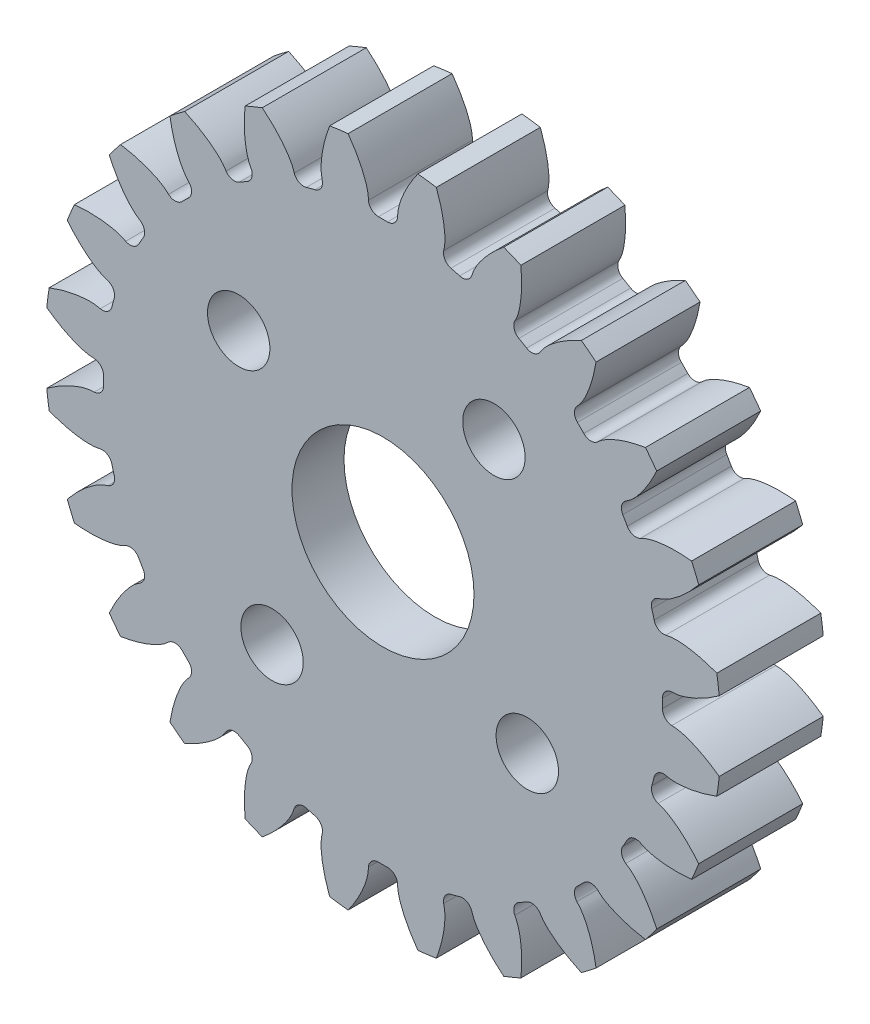
from build123d import *

# Parameters (mm, degrees)
SKETCH_1_R             = 13
LASHENA_DEPTH          = 4
CUT_EXTRUDEA_DEPTH     = 30
WWW_KYTOOL_CN_COUNT    = 24
SKETCH_3_R             = 10.375
CUT_EXTRUDE_2_DEPTH    = 2
HOLE_WIZARD_M2_2_D     = 2.4
HOLE_WIZARD_M2_2_DEPTH = 4
CUT_EXTRUDE_3_REACH    = 20.719
SKETCH_8_R             = 3.5


with BuildPart() as part:
    # 草图1 → LaShenA (new body)
    with BuildSketch(Plane.XY):
        Circle(SKETCH_1_R)
    extrude(amount=LASHENA_DEPTH)

    # SketchA → Cut-ExtrudeA (cut)
    with BuildSketch(Plane.XY.offset(4)):
        with BuildLine():
            ThreePointArc((0.173196471, 10.748604699), (0, 10.75), (-0.173196471, 10.748604699))
            ThreePointArc((-0.173196471, 10.748604699), (-0.437444919, 10.849681053), (-0.558609121, 11.105342759))
            add(Edge.make_bspline(
                [(-0.558609121, 11.105342759), (-0.561820005, 11.157808071), (-0.566676225, 11.241465147), (-0.579520194, 11.338853193), (-0.591720059, 11.399886775), (-0.602526477, 11.448246148), (-0.616487252, 11.503691621), (-0.63391432, 11.566103122), (-0.655198403, 11.635327615), (-0.680697435, 11.711203529), (-0.710772051, 11.793553084), (-0.745773672, 11.882184991), (-0.786047574, 11.976893898), (-0.831931307, 12.077460861), (-0.883754559, 12.183653528), (-0.941838585, 12.295226429), (-1.006495777, 12.411921251), (-1.078029212, 12.533467138), (-1.15673221, 12.659581005), (-1.2428879, 12.789967867), (-1.336768835, 12.924321173), (-1.438636448, 13.062323173), (-1.58856632, 13.254761753), (-1.709157908, 13.397453874), (-1.793555093, 13.492413967)],
                knots=[0.11976657, 0.11976657, 0.11976657, 0.11976657, 0.170317048, 0.200987551, 0.214488531, 0.230444233, 0.248854659, 0.269719807, 0.29303968, 0.318814275, 0.347043594, 0.377727635, 0.410866401, 0.446459889, 0.484508101, 0.525011036, 0.567968694, 0.613381076, 0.661248181, 0.711570009, 0.764346561, 0.819577836, 0.877263834, 1, 1, 1, 1], degree=3))
            ThreePointArc((-1.793555093, 13.492413967), (0, 13.611101151), (1.793555093, 13.492413967))
            add(Edge.make_bspline(
                [(0.558609121, 11.105342759), (0.561820005, 11.157808071), (0.566676225, 11.241465147), (0.579520194, 11.338853193), (0.591720059, 11.399886775), (0.602526477, 11.448246148), (0.616487252, 11.503691621), (0.63391432, 11.566103122), (0.655198403, 11.635327615), (0.680697435, 11.711203529), (0.710772051, 11.793553084), (0.745773672, 11.882184991), (0.786047574, 11.976893898), (0.831931307, 12.077460861), (0.883754559, 12.183653528), (0.941838585, 12.295226429), (1.006495777, 12.411921251), (1.078029212, 12.533467138), (1.15673221, 12.659581005), (1.2428879, 12.789967867), (1.336768835, 12.924321173), (1.438636448, 13.062323173), (1.58856632, 13.254761753), (1.709157908, 13.397453874), (1.793555093, 13.492413967)],
                knots=[0.11976657, 0.11976657, 0.11976657, 0.11976657, 0.170317048, 0.200987551, 0.214488531, 0.230444233, 0.248854659, 0.269719807, 0.29303968, 0.318814275, 0.347043594, 0.377727635, 0.410866401, 0.446459889, 0.484508101, 0.525011036, 0.567968694, 0.613381076, 0.661248181, 0.711570009, 0.764346561, 0.819577836, 0.877263834, 1, 1, 1, 1], degree=3))
            ThreePointArc((0.558609121, 11.105342759), (0.437444919, 10.849681053), (0.173196471, 10.748604699))
        make_face()
    cut_extrudea = extrude(amount=-CUT_EXTRUDEA_DEPTH, mode=Mode.SUBTRACT)

    # www.KYTool.cn: Cut-ExtrudeA ×24 about axis
    www_kytool_cn_axis = Axis((0, 0, -88.99), (0, 0, 1))
    for i in range(1, WWW_KYTOOL_CN_COUNT):
        add(cut_extrudea.rotate(www_kytool_cn_axis, i * 360 / WWW_KYTOOL_CN_COUNT), mode=Mode.SUBTRACT)

    # 草图3 → 切除-拉伸2 (cut)
    with BuildSketch(Plane(origin=(0, 0, 0), x_dir=(-1, 0, 0), z_dir=(0, 0, -1))):
        Circle(SKETCH_3_R)
    extrude(amount=-CUT_EXTRUDE_2_DEPTH, mode=Mode.SUBTRACT)

    # M2 间隙孔2
    with Locations(Plane.XY.offset(4)):
        with Locations((195.436640076, 197.494543198), (-5.549494935, 4.26650981), (4.26650981, 5.549494935), (-4.26650981, -5.549494935), (5.549494935, -4.26650981)):
            Hole(HOLE_WIZARD_M2_2_D / 2, depth=HOLE_WIZARD_M2_2_DEPTH)

    # 草图8 → 切除-拉伸3 (cut, up to next)
    with BuildSketch(Plane.XY.offset(4), mode=Mode.PRIVATE) as cut_extrude_3_sk1:
        Circle(SKETCH_8_R)
    cut_extrude_3_tool1 = extrude(cut_extrude_3_sk1.sketch, amount=-CUT_EXTRUDE_3_REACH, mode=Mode.PRIVATE) & part.part
    add(cut_extrude_3_tool1.solids().sort_by_distance((0, 0, 4))[0], mode=Mode.SUBTRACT)


solid = part.part
